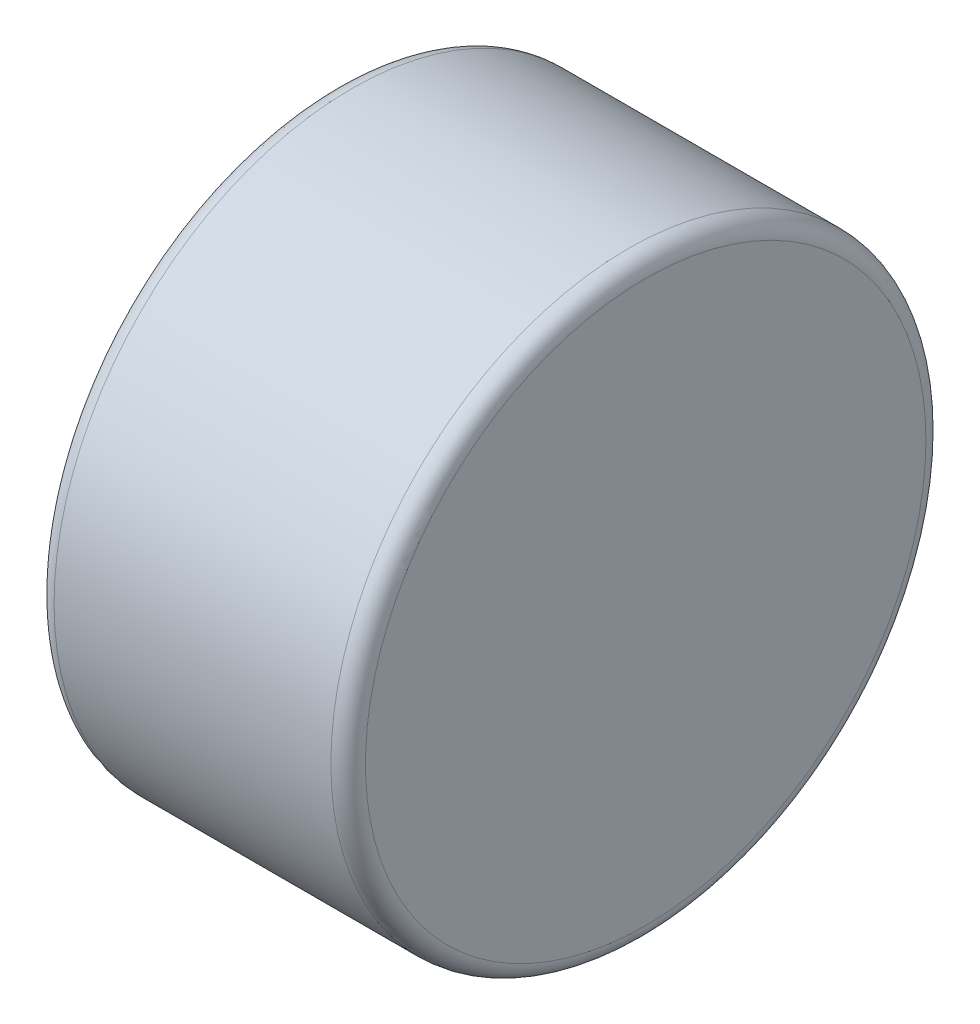
from build123d import *

# Parameters (mm, degrees)
SKETCH2_R           = 34.4
BOSS_EXTRUDE1_DEPTH = 36
FILLET1_R           = 2


with BuildPart() as part:
    # Sketch2 → Boss-Extrude1 (new body)
    with BuildSketch(Plane(origin=(0, 0, 0), x_dir=(0, 0, -1), z_dir=(1, 0, 0))):
        Circle(SKETCH2_R)
    extrude(amount=BOSS_EXTRUDE1_DEPTH)

    # Fillet1
    fillet1_edges = [part.edges().sort_by_distance(p)[0] for p in [
        (0, 0, 34.4),
        (36, 0, 34.4),
    ]]
    fillet(fillet1_edges, radius=FILLET1_R)


solid = part.part
